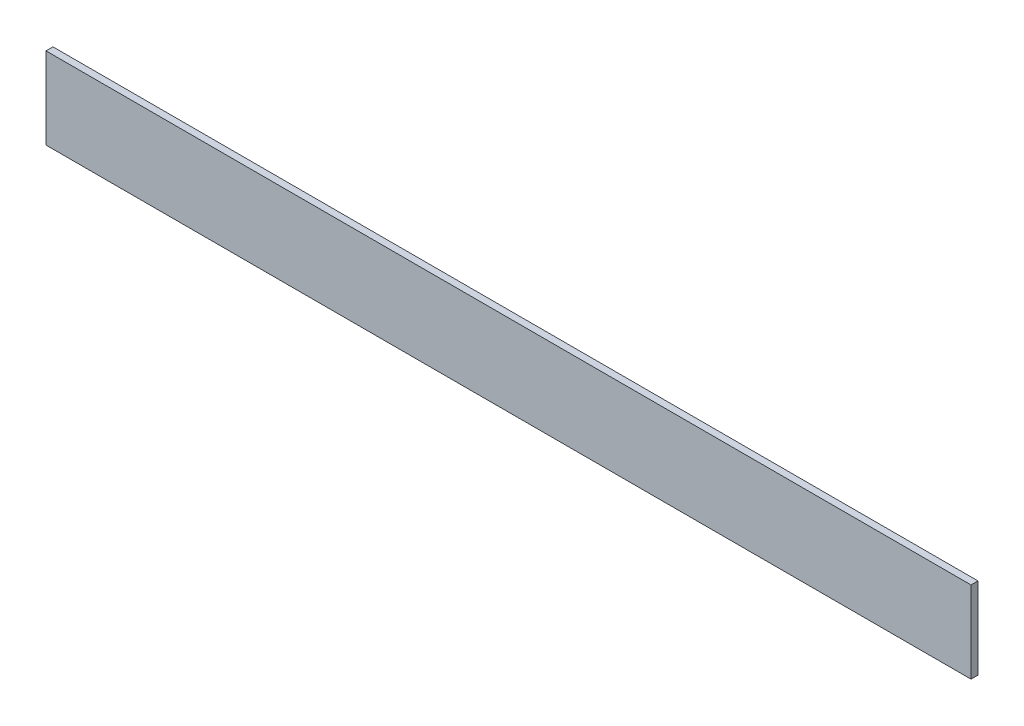
from build123d import *

# Parameters (mm, degrees)
BOSS_EXTRUDE1_DEPTH = 215.9
CUT_EXTRUDE1_REACH  = 218.811
SKETCH2_W           = 19.05
SKETCH2_H           = 17.4244


with BuildPart() as part:
    # Sketch1 → Boss-Extrude1 (new body)
    with BuildSketch(Plane(origin=(0, 0, 0), x_dir=(0, 0, -1), z_dir=(1, 0, 0))):
        Polygon((-7.8994, -7.8994), (9.525, -7.8994), (9.525, -9.525), (-9.525, -9.525), (-9.525, 9.525), (-7.8994, 9.525), align=None)
    extrude(amount=BOSS_EXTRUDE1_DEPTH)

    # Sketch2 → Cut-Extrude1 (cut, up to next)
    with BuildSketch(Plane(origin=(0, -7.8994, 0), x_dir=(1, 0, 0), z_dir=(0, 1, 0)), mode=Mode.PRIVATE) as cut_extrude1_sk1:
        with Locations((9.525, 0.8128)):
            Rectangle(SKETCH2_W, SKETCH2_H)
    cut_extrude1_tool1 = extrude(cut_extrude1_sk1.sketch, amount=-CUT_EXTRUDE1_REACH, mode=Mode.PRIVATE) & part.part
    # Sketch2 → Cut-Extrude1 (cut, up to next)
    with BuildSketch(Plane(origin=(0, -7.8994, 0), x_dir=(1, 0, 0), z_dir=(0, 1, 0)), mode=Mode.PRIVATE) as cut_extrude1_sk2:
        with Locations((206.375, 0.8128)):
            Rectangle(SKETCH2_W, SKETCH2_H)
    cut_extrude1_tool2 = extrude(cut_extrude1_sk2.sketch, amount=-CUT_EXTRUDE1_REACH, mode=Mode.PRIVATE) & part.part
    add(cut_extrude1_tool1.solids().sort_by_distance((9.525, -7.8994, -0.8128))[0], mode=Mode.SUBTRACT)
    add(cut_extrude1_tool2.solids().sort_by_distance((206.375, -7.8994, -0.8128))[0], mode=Mode.SUBTRACT)


solid = part.part
